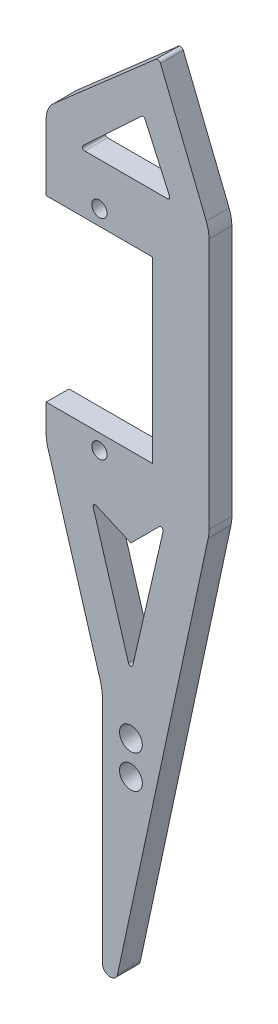
from build123d import *

# Parameters (mm, degrees)
SKETCH1_R           = 1
SKETCH1_R_2         = 1.5
BOSS_EXTRUDE1_DEPTH = 3


with BuildPart() as part:
    # Sketch1 → Boss-Extrude1 (new body)
    with BuildSketch(Plane.XY):
        with BuildLine():
            Line((-59.247809755, 25.254592271), (-59.247809755, 18.533720681))
            Line((-59.247809755, 18.533720681), (-45.247809755, 18.533720681))
            Line((-45.247809755, 18.533720681), (-45.247809755, -4.966279319))
            Line((-45.247809755, -4.966279319), (-59.247809755, -4.966279319))
            Line((-59.247809755, -4.966279319), (-59.247809755, -8.575462785))
            ThreePointArc((-59.247809755, -8.575462785), (-59.195128163, -9.299369248), (-59.038193528, -10.008021094))
            Line((-59.038193528, -10.008021094), (-52.173270473, -32.963886693))
            ThreePointArc((-52.173270473, -32.963886693), (-51.922175056, -34.097729646), (-51.83788451, -35.255979988))
            Line((-51.83788451, -35.255979988), (-51.83788451, -65.202303041))
            ThreePointArc((-51.83788451, -65.202303041), (-50.943230184, -66.196738704), (-49.860079932, -65.411822033))
            Line((-49.860079932, -65.411822033), (-37.949217773, -9.824997069))
            ThreePointArc((-37.949217773, -9.824997069), (-37.866062344, -9.304130483), (-37.838240661, -8.777402109))
            Line((-37.838240661, -8.777402109), (-37.838240661, 24.285754655))
            ThreePointArc((-37.838240661, 24.285754655), (-37.929542195, 25.236900999), (-38.200112409, 26.153310895))
            Line((-38.200112409, 26.153310895), (-44.217426695, 41.09747953))
            ThreePointArc((-44.217426695, 41.09747953), (-44.495580184, 41.337138252), (-44.852002492, 41.248997433))
            Line((-44.852002492, 41.248997433), (-58.224251279, 29.538573021))
            ThreePointArc((-58.224251279, 29.538573021), (-58.979963171, 28.520742463), (-59.247809755, 27.28165501))
            Line((-59.247809755, 27.28165501), (-59.247809755, 25.254592271))
        make_face()
        with Locations((-52.247809755, 20.533720681)):
            Circle(SKETCH1_R, mode=Mode.SUBTRACT)
        with Locations((-52.247809755, -6.966279319)):
            Circle(SKETCH1_R, mode=Mode.SUBTRACT)
        with Locations((-48.107299335, -37.682543737)):
            Circle(SKETCH1_R_2, mode=Mode.SUBTRACT)
        with Locations((-48.107299335, -42.050855836)):
            Circle(SKETCH1_R_2, mode=Mode.SUBTRACT)
        with BuildLine():
            Line((-46.243433747, 33.726215246), (-43.028458535, 26.576341757))
            ThreePointArc((-43.028458535, 26.576341757), (-43.050168294, 26.290383394), (-43.302070317, 26.153310895))
            Line((-43.302070317, 26.153310895), (-54.174570897, 26.153310895))
            ThreePointArc((-54.174570897, 26.153310895), (-54.453661171, 26.343271723), (-54.379309982, 26.672586766))
            Line((-54.379309982, 26.672586766), (-46.721784613, 33.822460255))
            ThreePointArc((-46.721784613, 33.822460255), (-46.457870892, 33.897290424), (-46.243433747, 33.726215246))
        make_face(mode=Mode.SUBTRACT)
        with BuildLine():
            Line((-48.107299335, -15.436077517), (-44.378825251, -11.707603433))
            ThreePointArc((-44.378825251, -11.707603433), (-44.021262657, -11.657342723), (-43.874375858, -11.987193319))
            Line((-43.874375858, -11.987193319), (-47.853011905, -29.227949523))
            ThreePointArc((-47.853011905, -29.227949523), (-48.135577902, -29.460333147), (-48.432645874, -29.246800218))
            Line((-48.432645874, -29.246800218), (-53.066527122, -13.820853431))
            ThreePointArc((-53.066527122, -13.820853431), (-52.978484336, -13.510290691), (-52.659725089, -13.459366335))
            Line((-52.659725089, -13.459366335), (-48.107299335, -15.436077517))
        make_face(mode=Mode.SUBTRACT)
    extrude(amount=BOSS_EXTRUDE1_DEPTH)


solid = part.part
